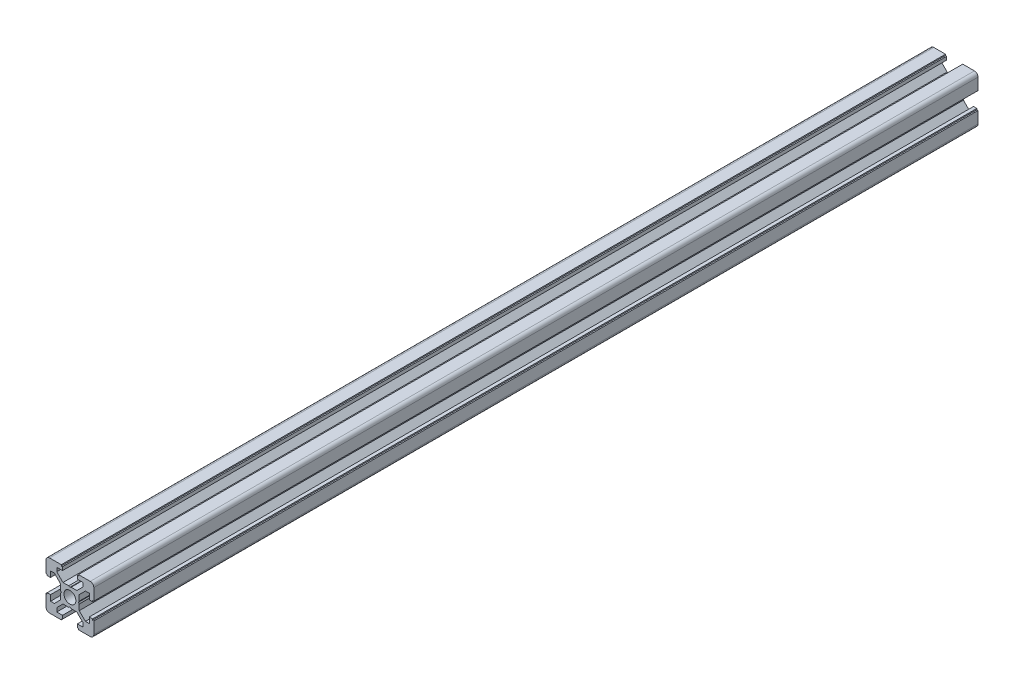
from build123d import *

# Parameters (mm, degrees)
MODEL_R         = 2.5
EXTRUDE_1_DEPTH = 370


with BuildPart() as part:
    # Model → 凸台-拉伸1 (new body)
    with BuildSketch(Plane.XY):
        with BuildLine():
            Line((-3.9, 0.519615242), (-3.6, 0))
            Line((-3.6, 0), (-3.9, -0.519615242))
            Line((-3.9, -0.519615242), (-3.9, -2.910050506))
            Line((-3.9, -2.910050506), (-6.489949494, -5.5))
            Line((-6.489949494, -5.5), (-8.1, -5.5))
            Line((-8.1, -5.5), (-8.1, -3.1))
            Line((-8.1, -3.1), (-9.5, -3.1))
            Line((-9.5, -3.1), (-9.5, -3.6))
            Line((-9.5, -3.6), (-10, -3.6))
            Line((-10, -3.6), (-10, -8.5))
            ThreePointArc((-10, -8.5), (-9.560660172, -9.560660172), (-8.5, -10))
            Line((-8.5, -10), (-3.6, -10))
            Line((-3.6, -10), (-3.6, -9.5))
            Line((-3.6, -9.5), (-3.1, -9.5))
            Line((-3.1, -9.5), (-3.1, -8.1))
            Line((-3.1, -8.1), (-5.5, -8.1))
            Line((-5.5, -8.1), (-5.5, -6.489949494))
            Line((-5.5, -6.489949494), (-2.910050506, -3.9))
            Line((-2.910050506, -3.9), (-0.519615242, -3.9))
            Line((-0.519615242, -3.9), (0, -3.6))
            Line((0, -3.6), (0.519615242, -3.9))
            Line((0.519615242, -3.9), (2.910050506, -3.9))
            Line((2.910050506, -3.9), (5.5, -6.489949494))
            Line((5.5, -6.489949494), (5.5, -8.1))
            Line((5.5, -8.1), (3.1, -8.1))
            Line((3.1, -8.1), (3.1, -9.5))
            Line((3.1, -9.5), (3.6, -9.5))
            Line((3.6, -9.5), (3.6, -10))
            Line((3.6, -10), (8.5, -10))
            ThreePointArc((8.5, -10), (9.560660172, -9.560660172), (10, -8.5))
            Line((10, -8.5), (10, -3.6))
            Line((10, -3.6), (9.5, -3.6))
            Line((9.5, -3.6), (9.5, -3.1))
            Line((9.5, -3.1), (8.1, -3.1))
            Line((8.1, -3.1), (8.1, -5.5))
            Line((8.1, -5.5), (6.489949494, -5.5))
            Line((6.489949494, -5.5), (3.9, -2.910050506))
            Line((3.9, -2.910050506), (3.9, -0.519615242))
            Line((3.9, -0.519615242), (3.6, 0))
            Line((3.6, 0), (3.9, 0.519615242))
            Line((3.9, 0.519615242), (3.9, 2.910050506))
            Line((3.9, 2.910050506), (6.489949494, 5.5))
            Line((6.489949494, 5.5), (8.1, 5.5))
            Line((8.1, 5.5), (8.1, 3.1))
            Line((8.1, 3.1), (9.5, 3.1))
            Line((9.5, 3.1), (9.5, 3.6))
            Line((9.5, 3.6), (10, 3.6))
            Line((10, 3.6), (10, 8.5))
            ThreePointArc((10, 8.5), (9.560660172, 9.560660172), (8.5, 10))
            Line((8.5, 10), (3.6, 10))
            Line((3.6, 10), (3.6, 9.5))
            Line((3.6, 9.5), (3.1, 9.5))
            Line((3.1, 9.5), (3.1, 8.1))
            Line((3.1, 8.1), (5.5, 8.1))
            Line((5.5, 8.1), (5.5, 6.489949494))
            Line((5.5, 6.489949494), (2.910050506, 3.9))
            Line((2.910050506, 3.9), (0.519615242, 3.9))
            Line((0.519615242, 3.9), (0, 3.6))
            Line((0, 3.6), (-0.519615242, 3.9))
            Line((-0.519615242, 3.9), (-2.910050506, 3.9))
            Line((-2.910050506, 3.9), (-5.5, 6.489949494))
            Line((-5.5, 6.489949494), (-5.5, 8.1))
            Line((-5.5, 8.1), (-3.1, 8.1))
            Line((-3.1, 8.1), (-3.1, 9.5))
            Line((-3.1, 9.5), (-3.6, 9.5))
            Line((-3.6, 9.5), (-3.6, 10))
            Line((-3.6, 10), (-8.5, 10))
            ThreePointArc((-8.5, 10), (-9.560660172, 9.560660172), (-10, 8.5))
            Line((-10, 8.5), (-10, 3.6))
            Line((-10, 3.6), (-9.5, 3.6))
            Line((-9.5, 3.6), (-9.5, 3.1))
            Line((-9.5, 3.1), (-8.1, 3.1))
            Line((-8.1, 3.1), (-8.1, 5.5))
            Line((-8.1, 5.5), (-6.489949494, 5.5))
            Line((-6.489949494, 5.5), (-3.9, 2.910050506))
            Line((-3.9, 2.910050506), (-3.9, 0.519615242))
        make_face()
        Circle(MODEL_R, mode=Mode.SUBTRACT)
    extrude(amount=EXTRUDE_1_DEPTH)


solid = part.part
